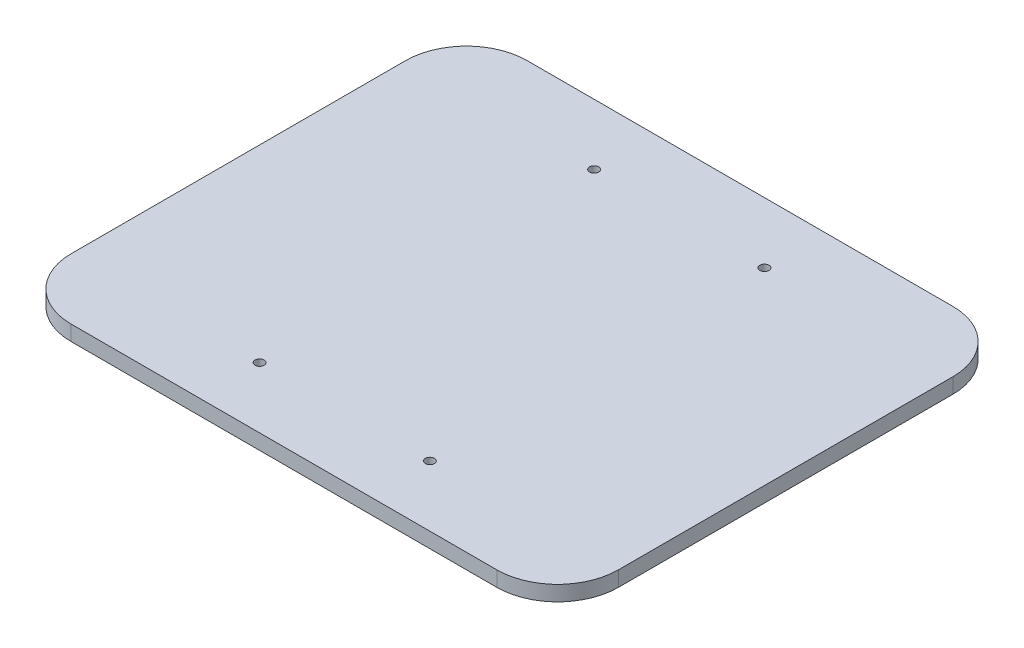
from build123d import *

# Parameters (mm, degrees)
RESSALTO_EXTRUS_O1_DEPTH = 5
ESBO_O2_R                = 1.5
CORTE_EXTRUS_O1_DEPTH    = 10


with BuildPart() as part:
    # Esboço1 → Ressalto-extrusão1 (new body)
    with BuildSketch(Plane(origin=(0, 0, 0), x_dir=(1, 0, 0), z_dir=(0, 1, 0))):
        with BuildLine():
            Line((-40.816022398, 183.1144834), (99.183977602, 183.1144834))
            ThreePointArc((99.183977602, 183.1144834), (113.326113225, 177.256619024), (119.183977602, 163.1144834))
            Line((119.183977602, 163.1144834), (119.183977602, 53.1144834))
            ThreePointArc((119.183977602, 53.1144834), (113.326113225, 38.972347776), (99.183977602, 33.1144834))
            Line((99.183977602, 33.1144834), (-40.816022398, 33.1144834))
            ThreePointArc((-40.816022398, 33.1144834), (-54.958158022, 38.972347776), (-60.816022398, 53.1144834))
            Line((-60.816022398, 53.1144834), (-60.816022398, 163.1144834))
            ThreePointArc((-60.816022398, 163.1144834), (-54.958158022, 177.256619024), (-40.816022398, 183.1144834))
        make_face()
    extrude(amount=RESSALTO_EXTRUS_O1_DEPTH)

    # Esboço2 → Corte-extrusão1 (cut)
    with BuildSketch(Plane(origin=(0, 5, 0), x_dir=(1, 0, 0), z_dir=(0, 1, 0))):
        with Locations(Location((1.183977602, 163.1144834, 0), (0, 0, 270))):
            Circle(ESBO_O2_R)
        with Locations(Location((57.183977602, 163.1144834, 0), (0, 0, 270))):
            Circle(ESBO_O2_R)
        with Locations(Location((57.183977602, 53.1144834, 0), (0, 0, 270))):
            Circle(ESBO_O2_R)
        with Locations(Location((1.183977602, 53.1144834, 0), (0, 0, 270))):
            Circle(ESBO_O2_R)
    extrude(amount=-CORTE_EXTRUS_O1_DEPTH, mode=Mode.SUBTRACT)


solid = part.part
